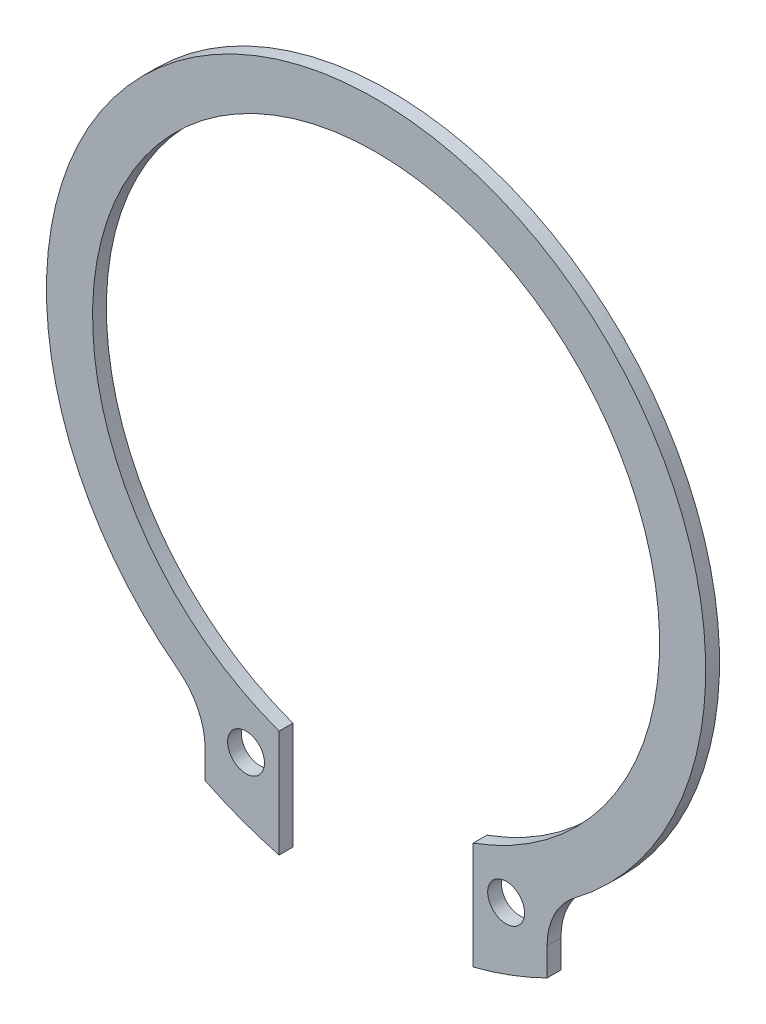
from build123d import *

# Parameters (mm, degrees)
ESQUISSE1_R        = 4
BOSS_EXTRU_1_DEPTH = 3


with BuildPart() as part:
    # Esquisse1 → Boss.-Extru.1 (new body)
    with BuildSketch(Plane.XY):
        with BuildLine():
            Line((-21.034238815, -57.791096178), (-21.034238815, -81.072422518))
            ThreePointArc((-21.034238815, -81.072422518), (-29.215924567, -78.495902105), (-37.091180109, -75.096080148))
            Line((-37.091180109, -75.096080148), (-37.091180109, -69.056201422))
            ThreePointArc((-37.091180109, -69.056201422), (-38.665509003, -62.366556039), (-43.058027489, -57.081137592))
            ThreePointArc((-43.058027489, -57.081137592), (0, 71.5), (43.058027489, -57.081137592))
            ThreePointArc((43.058027489, -57.081137592), (38.665509003, -62.366556039), (37.091180109, -69.056201422))
            Line((37.091180109, -69.056201422), (37.091180109, -75.096080148))
            ThreePointArc((37.091180109, -75.096080148), (29.215924567, -78.495902105), (21.034238815, -81.072422518))
            Line((21.034238815, -81.072422518), (21.034238815, -57.791096178))
            ThreePointArc((21.034238815, -57.791096178), (0, 61.5), (-21.034238815, -57.791096178))
        make_face()
        with Locations((-28.202703448, -65.371545378)):
            Circle(ESQUISSE1_R, mode=Mode.SUBTRACT)
        with Locations(Location((28.202703448, -65.371545378, 0), (0, 0, 180))):
            Circle(ESQUISSE1_R, mode=Mode.SUBTRACT)
    extrude(amount=BOSS_EXTRU_1_DEPTH)


solid = part.part
